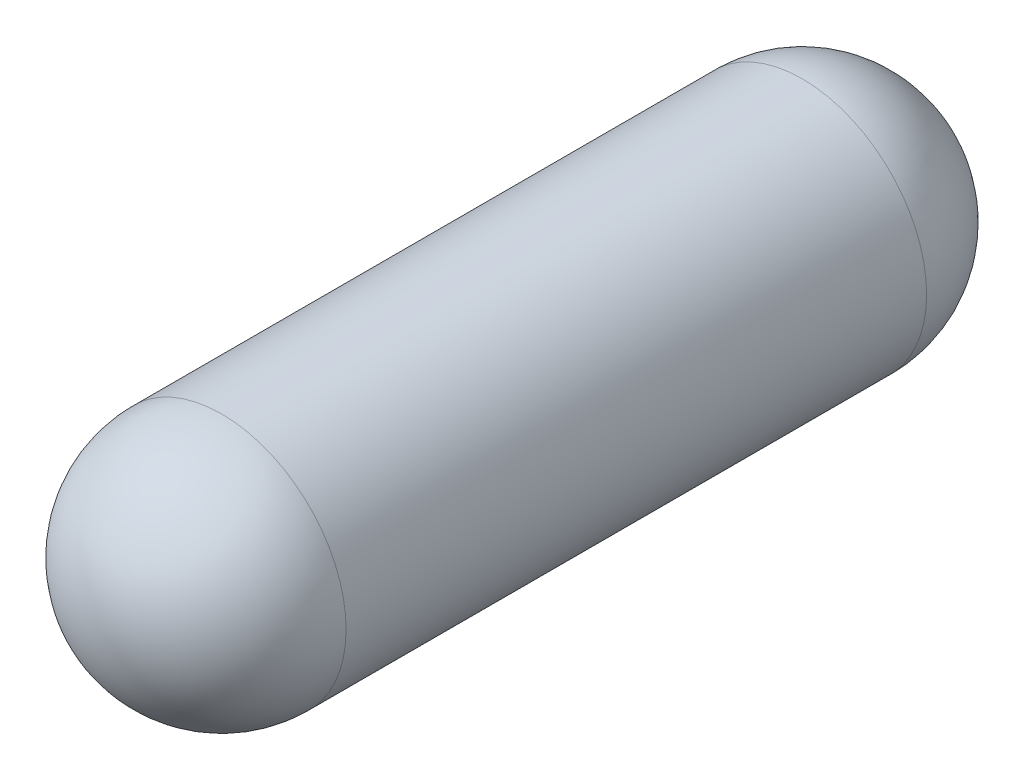
from build123d import *

# Parameters (mm, degrees)
CROQUIS1_R              = 3
SALIENTE_EXTRUIR1_DEPTH = 20
REDONDEO1_R             = 3


with BuildPart() as part:
    # Croquis1 → Saliente-Extruir1 (new body)
    with BuildSketch(Plane.XY):
        Circle(CROQUIS1_R)
    extrude(amount=SALIENTE_EXTRUIR1_DEPTH)

    # Redondeo1
    redondeo1_edges = [part.edges().sort_by_distance(p)[0] for p in [
        (-3, 0, 0),
        (-3, 0, 20),
    ]]
    fillet(redondeo1_edges, radius=REDONDEO1_R)


solid = part.part
